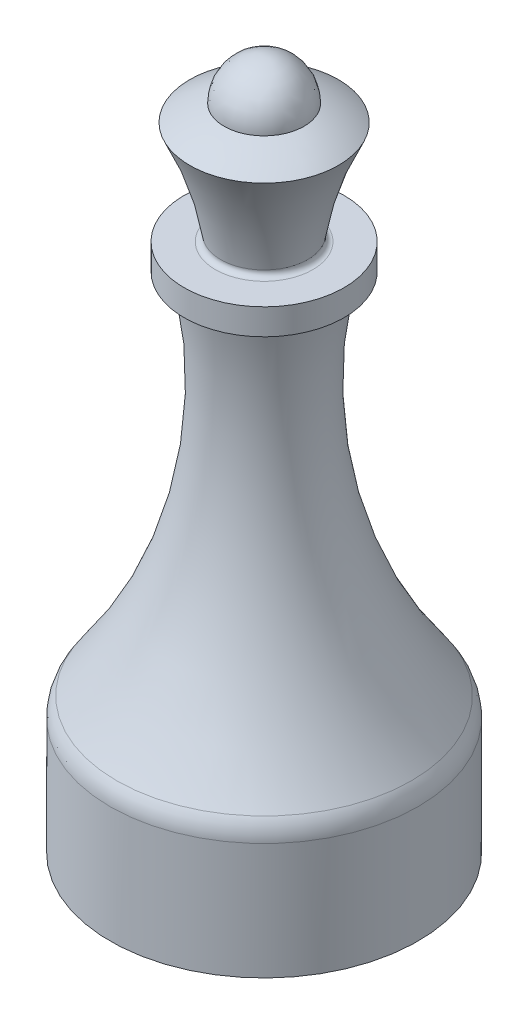
from build123d import *

# Parameters (mm, degrees)
FILLET1_R = 3
FILLET2_R = 0.5


with BuildPart() as part:
    # Sketch1 → Revolve2 (revolve)
    with BuildSketch(Plane.XY, mode=Mode.PRIVATE) as revolve2_sk:
        with BuildLine():
            Line((9.5, 12), (9.5, 0))
            Line((9.5, 0), (14.5, 0))
            Line((14.5, 0), (14.5, 12))
            ThreePointArc((14.5, 12), (6.46129463, 28.348941445), (6, 46.56146125))
            Line((6, 46.56146125), (7.536573788, 47.396000215))
            Line((7.536573788, 47.396000215), (7.536573788, 49.844035403))
            Line((7.536573788, 49.844035403), (4.016092882, 49.844035403))
            ThreePointArc((4.016092882, 49.844035403), (5.09741657, 54.8289558), (7.005928337, 59.559312565))
            ThreePointArc((7.005928337, 59.559312565), (5.43849666, 60.452627999), (3.765468303, 61.127780309))
            ThreePointArc((3.765468303, 61.127780309), (2.684487968, 63.843540801), (0, 65))
            Line((0, 65), (0, 30))
            Line((0, 30), (8.006428895, 17.203147345))
            ThreePointArc((8.006428895, 17.203147345), (9.11921693, 14.706635224), (9.5, 12))
        make_face()
    revolve(revolve2_sk.sketch.rotate(Axis((0, 0, 0), (0, 1, 0)), 90), axis=Axis((0, 0, 0), (0, 1, 0)))

    # Fillet1
    fillet1_edges = [part.edges().sort_by_distance(p)[0] for p in [
        (0, 12, 14.5),
    ]]
    fillet(fillet1_edges, radius=FILLET1_R)

    # Fillet2
    fillet2_edges = [part.edges().sort_by_distance(p)[0] for p in [
        (0, 49.844035403, 4.016092882),
    ]]
    fillet(fillet2_edges, radius=FILLET2_R)


solid = part.part
